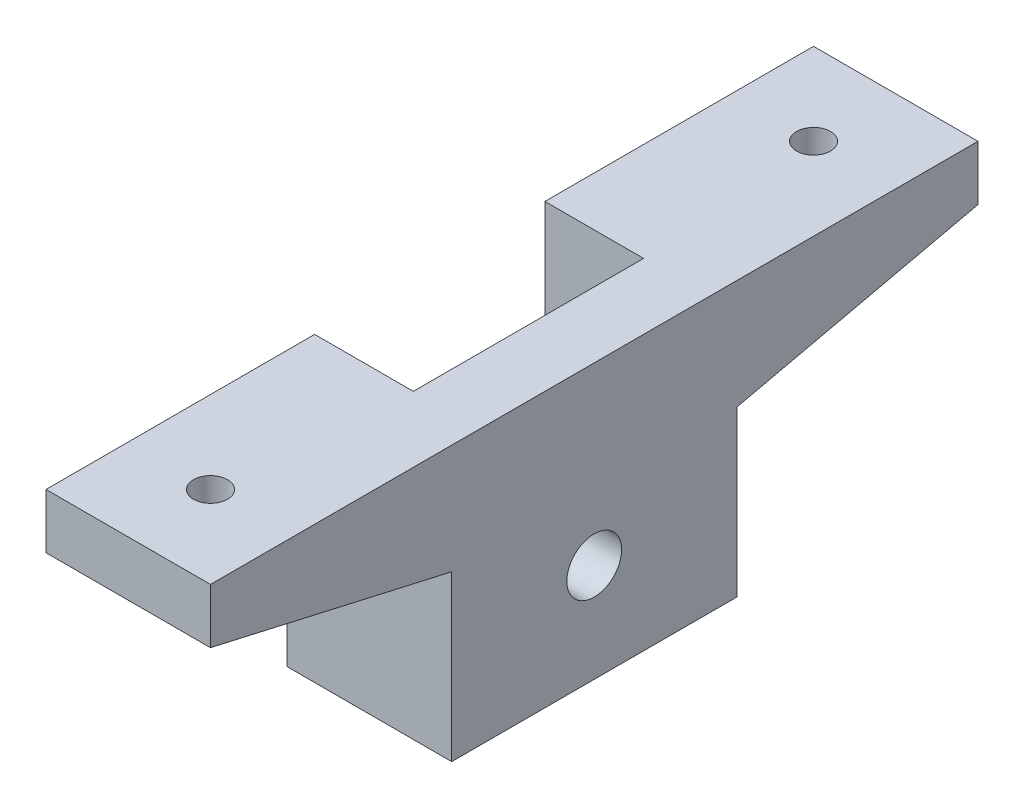
from build123d import *

# Parameters (mm, degrees)
SKETCH_1_W          = 15
SKETCH_1_H          = 70
EXTRUDE_1_DEPTH     = 25
CUT_EXTRUDE_1_DEPTH = 40
SKETCH_3_W          = 9
SKETCH_3_H          = 21
CUT_EXTRUDE_2_DEPTH = 76.828754441
SKETCH_5_R          = 1.55
CUT_EXTRUDE_3_DEPTH = 76.828754441
SKETCH_6_R          = 2.5
CUT_EXTRUDE_4_DEPTH = 76.828754441


with BuildPart() as part:
    # 草图1 → 凸台-拉伸1 (new body)
    with BuildSketch(Plane(origin=(0, 0, 0), x_dir=(1, 0, 0), z_dir=(0, 1, 0))):
        with Locations((7.5, -35)):
            Rectangle(SKETCH_1_W, SKETCH_1_H)
    extrude(amount=EXTRUDE_1_DEPTH)

    # 草图2 → 切除-拉伸1 (cut)
    with BuildSketch(Plane(origin=(15, 0, 0), x_dir=(0, 0, -1), z_dir=(1, 0, 0))):
        Polygon((-70, 20), (-48, 15), (-48, 0), (-70, 0), align=None)
        Polygon((0, 20), (-22, 15), (-22, 0), (0, 0), align=None)
    extrude(amount=-CUT_EXTRUDE_1_DEPTH, mode=Mode.SUBTRACT)

    # 草图3 → 切除-拉伸2 (cut, through all)
    with BuildSketch(Plane(origin=(0, 25, 0), x_dir=(1, 0, 0), z_dir=(0, 1, 0))):
        with Locations((4.5, -35)):
            Rectangle(SKETCH_3_W, SKETCH_3_H)
    extrude(amount=-CUT_EXTRUDE_2_DEPTH, mode=Mode.SUBTRACT)

    # 草图5 → 切除-拉伸3 (cut, through all)
    with BuildSketch(Plane(origin=(0, 25, 0), x_dir=(1, 0, 0), z_dir=(0, 1, 0))):
        with Locations(Location((7.5, -7.5, 0), (0, 0, 270))):
            Circle(SKETCH_5_R)
        with Locations(Location((7.5, -62.5, 0), (0, 0, 270))):
            Circle(SKETCH_5_R)
    extrude(amount=-CUT_EXTRUDE_3_DEPTH, mode=Mode.SUBTRACT)

    # 草图6 → 切除-拉伸4 (cut, through all)
    with BuildSketch(Plane(origin=(15, 0, 0), x_dir=(0, 0, -1), z_dir=(1, 0, 0))):
        with Locations((-35, 9)):
            Circle(SKETCH_6_R)
    extrude(amount=-CUT_EXTRUDE_4_DEPTH, mode=Mode.SUBTRACT)


solid = part.part
